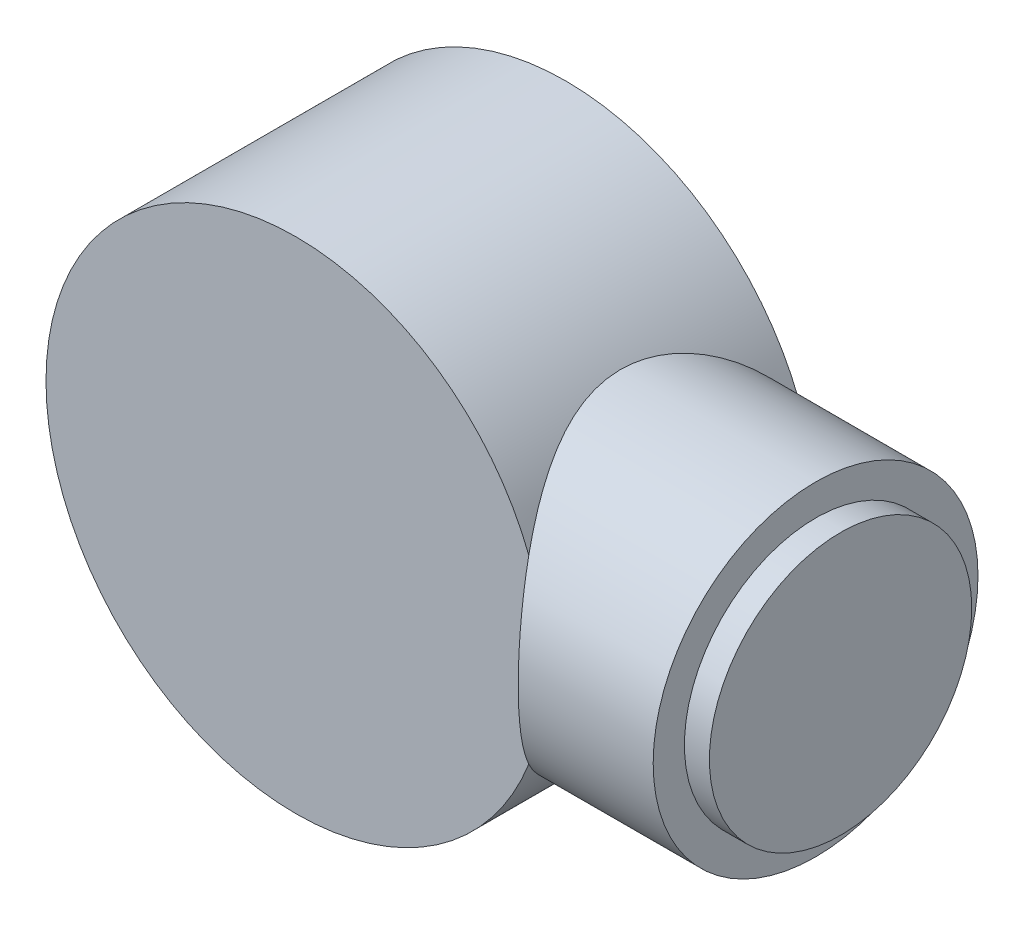
from build123d import *

# Parameters (mm, degrees)
SKETCH1_R                = 50
BOSS_EXTRUDE1_DEPTH      = 54
BOSS_EXTRUDE2_REACH      = 148.782
BOSS_EXTRUDE2_END_RADIUS = 50
SKETCH2_R                = 32.5
SKETCH3_R                = 26.25
BOSS_EXTRUDE3_DEPTH      = 5


with BuildPart() as part:
    # Sketch1 → Boss-Extrude1 (new body)
    with BuildSketch(Plane.XY):
        Circle(SKETCH1_R)
    extrude(amount=BOSS_EXTRUDE1_DEPTH)

    # Boss-Extrude2: up to this cylinder (the profile starts outside it)
    boss_extrude2_end = Plane(origin=(0, 0, 27), z_dir=(0, 0, -1)) * Cylinder(BOSS_EXTRUDE2_END_RADIUS, 398.564, mode=Mode.PRIVATE)
    # Sketch2 → Boss-Extrude2 (add, up to the surface)
    with BuildSketch(Plane(origin=(77, 0, 0), x_dir=(0, 0, -1), z_dir=(1, 0, 0)), mode=Mode.PRIVATE) as boss_extrude2_sk1:
        with Locations((-27, 0)):
            Circle(SKETCH2_R)
    boss_extrude2_tool1 = extrude(boss_extrude2_sk1.sketch, amount=-BOSS_EXTRUDE2_REACH, mode=Mode.PRIVATE) - boss_extrude2_end
    add(boss_extrude2_tool1.solids().sort_by_distance((77, 0, 27))[0])

    # Sketch3 → Boss-Extrude3 (add)
    with BuildSketch(Plane(origin=(77, 0, 0), x_dir=(0, 0, -1), z_dir=(1, 0, 0))):
        with Locations((-27, 0)):
            Circle(SKETCH3_R)
    extrude(amount=BOSS_EXTRUDE3_DEPTH)


solid = part.part
